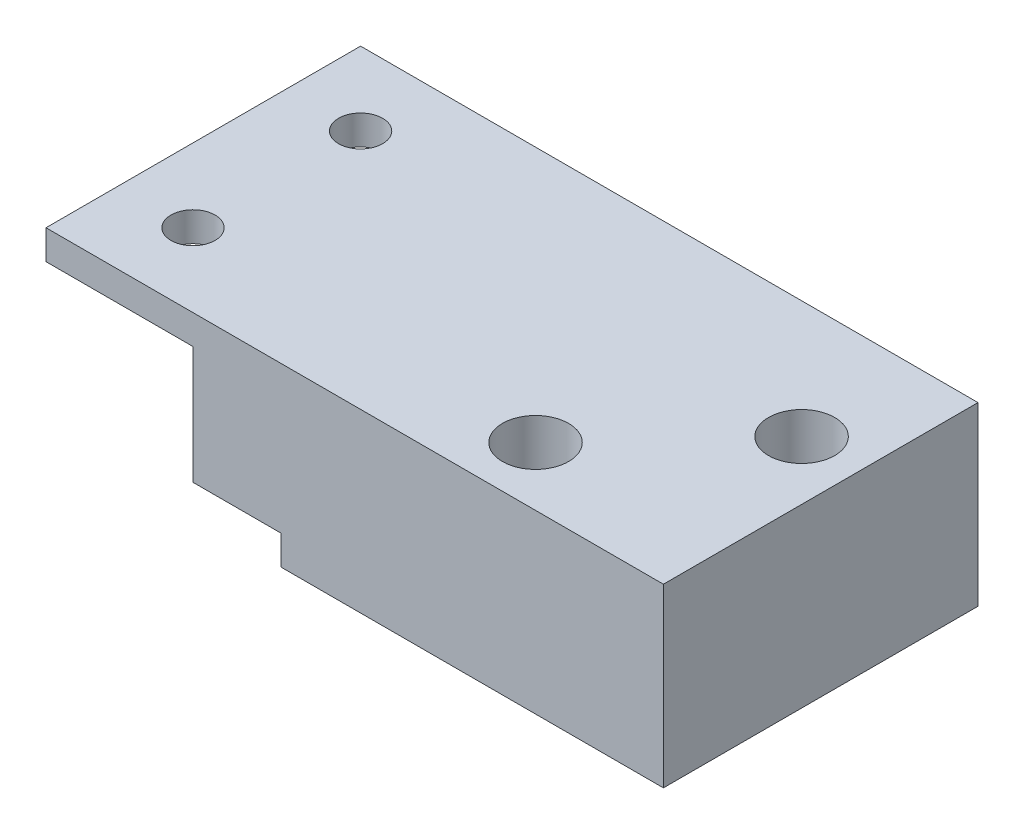
from build123d import *

# Parameters (mm, degrees)
SKETCH_1_W          = 42
SKETCH_1_H          = 21.4
EXTRUDE_1_DEPTH     = 12
SKETCH_2_W          = 6
SKETCH_2_H          = 2
CUT_EXTRUDE_1_DEPTH = 49.641134855
SKETCH_3_R          = 3.1
CUT_EXTRUDE_2_DEPTH = 2.6
SKETCH_4_R          = 2.25
CUT_EXTRUDE_3_DEPTH = 10
SKETCH_4_3_R        = 1.5
CUT_EXTRUDE_4_DEPTH = 49.641134855


with BuildPart() as part:
    # 草图1 → 凸台-拉伸1 (new body)
    with BuildSketch(Plane(origin=(0, 0, 0), x_dir=(1, 0, 0), z_dir=(0, 1, 0))):
        with Locations((21, -10.7)):
            Rectangle(SKETCH_1_W, SKETCH_1_H)
    extrude(amount=EXTRUDE_1_DEPTH)

    # 草图2 → 切除-拉伸1 (cut, through all)
    with BuildSketch(Plane(origin=(0, 0, 0), x_dir=(-1, 0, 0), z_dir=(0, 0, -1))):
        Polygon((-10, 0), (0, 0), (0, 10), (-10, 10), (-10, 2), align=None)
        with Locations((-13, 1)):
            Rectangle(SKETCH_2_W, SKETCH_2_H)
    extrude(amount=-CUT_EXTRUDE_1_DEPTH, mode=Mode.SUBTRACT)

    # 草图3 → 切除-拉伸2 (cut)
    with BuildSketch(Plane.XZ):
        with Locations(Location((20.3, 14, 0), (0, 0, 270))):
            Circle(SKETCH_3_R)
    extrude(amount=-CUT_EXTRUDE_2_DEPTH, mode=Mode.SUBTRACT)

    # 草图4 → 切除-拉伸3 (cut)
    with BuildSketch(Plane(origin=(0, 12, 0), x_dir=(1, 0, 0), z_dir=(0, 1, 0))):
        with Locations(Location((29.3, -17.4, 0), (0, 0, 270))):
            Circle(SKETCH_4_R)
        with Locations(Location((38, -8, 0), (0, 0, 270))):
            Circle(SKETCH_4_R)
    extrude(amount=-CUT_EXTRUDE_3_DEPTH, mode=Mode.SUBTRACT)

    # 草图4<3> → 切除-拉伸4 (cut, through all)
    with BuildSketch(Plane(origin=(0, 12, 0), x_dir=(1, 0, 0), z_dir=(0, 1, 0))):
        with Locations(Location((5, -5, 0), (0, 0, 270))):
            Circle(SKETCH_4_3_R)
        with Locations(Location((5, -16.4, 0), (0, 0, 270))):
            Circle(SKETCH_4_3_R)
        with Locations(Location((38, -8, 0), (0, 0, 270))):
            Circle(SKETCH_4_3_R)
        with Locations(Location((29.3, -17.4, 0), (0, 0, 270))):
            Circle(SKETCH_4_3_R)
    extrude(amount=-CUT_EXTRUDE_4_DEPTH, mode=Mode.SUBTRACT)


solid = part.part
